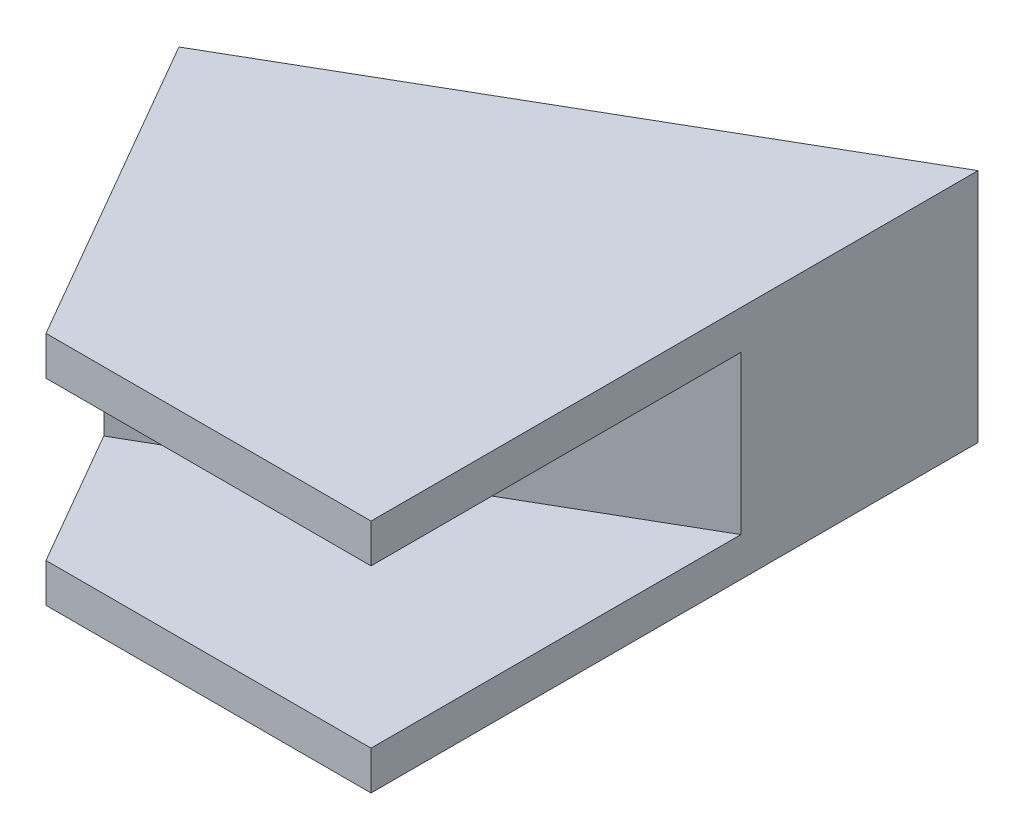
from build123d import *

# Parameters (mm, degrees)
BOSS_EXTRUDE2_DEPTH = 5
BOSS_EXTRUDE3_DEPTH = 20.3
BOSS_EXTRUDE4_DEPTH = 5


with BuildPart() as part:
    # Sketch3 → Boss-Extrude2 (new body)
    with BuildSketch(Plane(origin=(0, 0, 0), x_dir=(1, 0, 0), z_dir=(0, 1, 0))):
        Polygon((-54.461524227, -2.229452052), (-41.811524227, -24.139894768), (0, -24.139894768), (0, 29.213923621), (0, 53.936652846), (-65.166780007, 16.312594867), align=None)
    extrude(amount=BOSS_EXTRUDE2_DEPTH)

    # Sketch4 → Boss-Extrude3 (add)
    with BuildSketch(Plane(origin=(0, 5, 0), x_dir=(1, 0, 0), z_dir=(0, 1, 0))):
        Polygon((-51.961524227, -6.559579071), (0, 23.440420929), (0, 29.213923621), (0, 53.936652846), (-65.166780007, 16.312594867), (-54.461524227, -2.229452052), align=None)
    extrude(amount=BOSS_EXTRUDE3_DEPTH)

    # Sketch5 → Boss-Extrude4 (add)
    with BuildSketch(Plane(origin=(0, 25.3, 0), x_dir=(1, 0, 0), z_dir=(0, 1, 0))):
        Polygon((-65.166780007, 16.312594867), (-41.811524227, -24.139894768), (0, -24.139894768), (0, 53.936652846), align=None)
    extrude(amount=BOSS_EXTRUDE4_DEPTH)


solid = part.part
